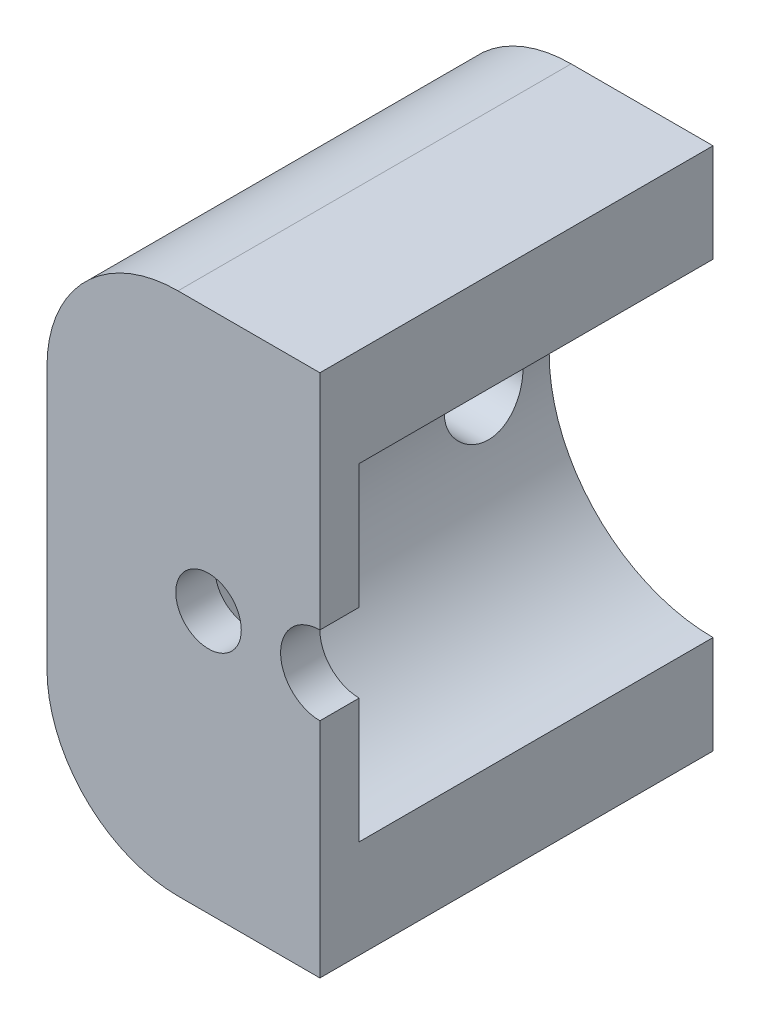
from build123d import *

# Parameters (mm, degrees)
BOSS_EXTRUDE1_DEPTH = 30
BOSS_EXTRUDE2_START = -3
SKETCH2_R           = 2.5
BOSS_EXTRUDE2_DEPTH = 3
SKETCH3_R           = 2
CUT_EXTRUDE1_DEPTH  = 42.638807138
SKETCH3_4_R         = 3
SKETCH3_4_R_2       = 2
CUT_EXTRUDE7_DEPTH  = 17
FILLET1_R           = 10


with BuildPart() as part:
    # Sketch1 → Boss-Extrude1 (new body)
    with BuildSketch(Plane.XY):
        with BuildLine():
            Line((-20.827632123, 20), (0, 20))
            Line((0, 20), (0, 12.5))
            ThreePointArc((0, 12.5), (-12.5, 0), (0, -12.5))
            Line((0, -12.5), (0, -20))
            Line((0, -20), (-20.827632123, -20))
            Line((-20.827632123, -20), (-20.827632123, 20))
        make_face()
    extrude(amount=BOSS_EXTRUDE1_DEPTH)

    # Sketch2 → Boss-Extrude2 (add)
    with BuildSketch(Plane.XY.offset(30).offset(BOSS_EXTRUDE2_START)):
        with BuildLine():
            Line((0, 12.5), (0, 3))
            ThreePointArc((0, 3), (-3, 0), (0, -3))
            Line((0, -3), (0, -12.5))
            ThreePointArc((0, -12.5), (-12.5, 0), (0, 12.5))
        make_face()
        with Locations((-8.5, 0)):
            Circle(SKETCH2_R, mode=Mode.SUBTRACT)
    extrude(amount=BOSS_EXTRUDE2_DEPTH)

    # Sketch3 → Cut-Extrude1 (cut, through all)
    with BuildSketch(Plane(origin=(0, 0, 0), x_dir=(0, 0, -1), z_dir=(1, 0, 0))):
        with Locations((-5, 0)):
            Circle(SKETCH3_R)
        with Locations((-20, 0)):
            Circle(SKETCH3_R)
    extrude(amount=-CUT_EXTRUDE1_DEPTH, mode=Mode.SUBTRACT)

    # Sketch3<4> → Cut-Extrude7 (cut)
    # profile 1 of 2: a face of its own
    with BuildSketch(Plane(origin=(0, 0, 0), x_dir=(0, 0, -1), z_dir=(1, 0, 0))):
        with Locations((-5, 0)):
            Circle(SKETCH3_4_R)
        with Locations((-5, 0)):
            Circle(SKETCH3_4_R_2, mode=Mode.SUBTRACT)
    # profile 2 of 2: a face of its own
    with BuildSketch(Plane(origin=(0, 0, 0), x_dir=(0, 0, -1), z_dir=(1, 0, 0))):
        with Locations((-20, 0)):
            Circle(SKETCH3_4_R)
        with Locations((-20, 0)):
            Circle(SKETCH3_4_R_2, mode=Mode.SUBTRACT)
    extrude(amount=-CUT_EXTRUDE7_DEPTH, mode=Mode.SUBTRACT)

    # Fillet1
    fillet1_edges = [part.edges().sort_by_distance(p)[0] for p in [
        (-20.827632123, -20, 15),
        (-20.827632123, 20, 15),
    ]]
    fillet(fillet1_edges, radius=FILLET1_R)


solid = part.part
